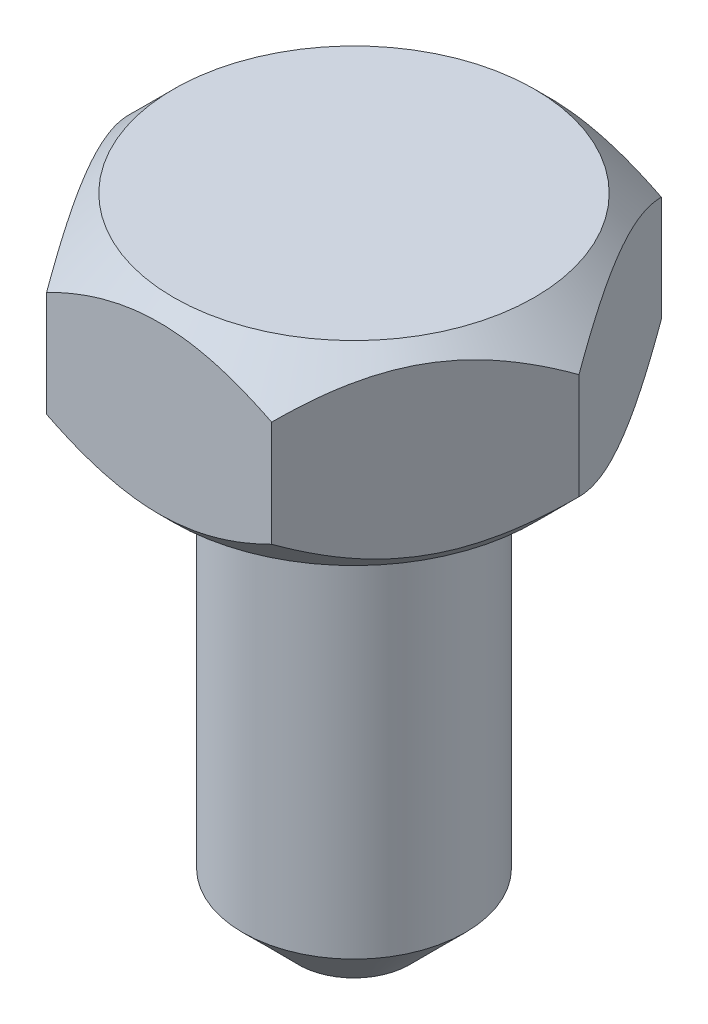
from build123d import *

# Parameters (mm, degrees)
EXTRUDE_1_DEPTH = 3.5
SKETCH_5_R      = 2
EXTRUDE_2_DEPTH = 8
CHAMFER_1_SIZE  = 1


with BuildPart() as part:
    # Эскиз1 → Вытянуть1 (new body)
    with BuildSketch(Plane(origin=(0, 0, 0), x_dir=(1, 0, 0), z_dir=(0, 1, 0))):
        Polygon((-2.020725942, 3.5), (2.020725942, 3.5), (4.041451884, 0), (2.020725942, -3.5), (-2.020725942, -3.5), (-4.041451884, 0), align=None)
    extrude(amount=-EXTRUDE_1_DEPTH)

    # Эскиз5 → Вытянуть2 (add)
    with BuildSketch(Plane.XZ.offset(3.5)):
        with Locations(Location((0, 0, 0), (0, 0, 90))):
            Circle(SKETCH_5_R)
    extrude(amount=EXTRUDE_2_DEPTH)

    # Фаска1
    chamfer_1_edges = [part.edges().sort_by_distance(p)[0] for p in [
        (0, -11.5, -2),
    ]]
    chamfer(chamfer_1_edges, length=CHAMFER_1_SIZE)

    # Эскиз4 → Вырез-Повернуть1 (revolve, cut)
    with BuildSketch(Plane.XY, mode=Mode.PRIVATE) as cut_revolve_1_sk:
        Polygon((-4.041451884, -0.8), (-3.241451884, 0), (-4.041451884, 0), align=None)
        Polygon((-4.041451884, -2.7), (-3.241451884, -3.5), (-4.041451884, -3.5), align=None)
    revolve(cut_revolve_1_sk.sketch.rotate(Axis((0, -3.5, 0), (0, -1, 0)), 120.000000136), axis=Axis((0, -3.5, 0), (0, -1, 0)), mode=Mode.SUBTRACT)


solid = part.part
